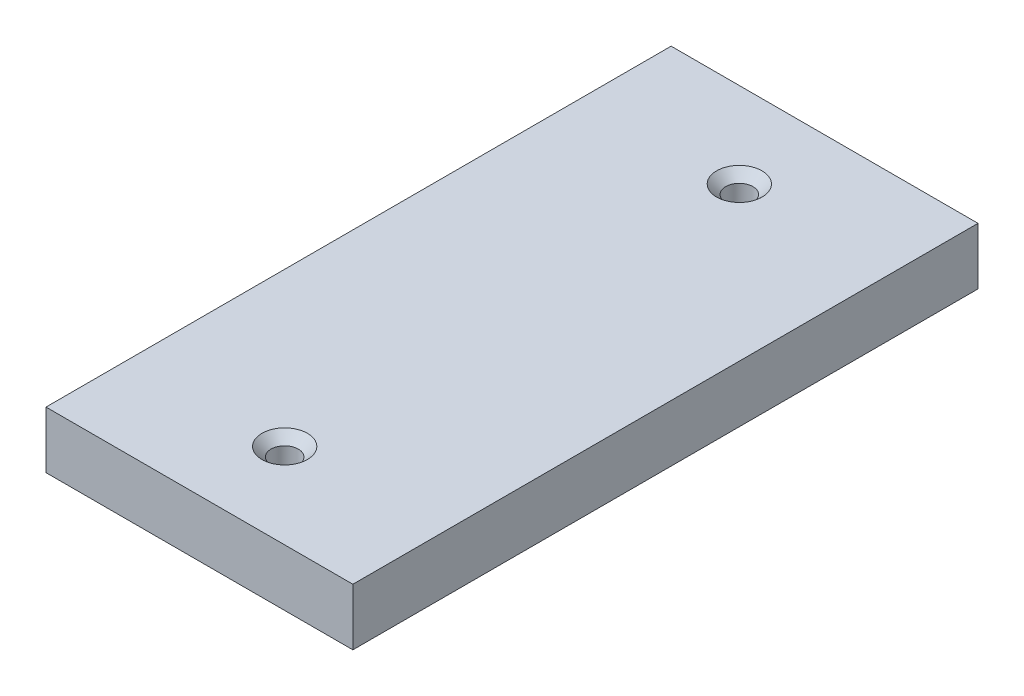
from build123d import *

# Parameters (mm, degrees)
SKETCH_2_W          = 54
SKETCH_2_H          = 110
EXTRUDE_1_DEPTH     = 5
CUT_EXTRUDE_1_REACH = 64.081
SKETCH_3_R          = 2.4
CHAMFER_1_SIZE      = 1.6


with BuildPart() as part:
    # Эскиз2 → Бобышка-Вытянуть1 (new, symmetric)
    with BuildSketch(Plane(origin=(0, 0, 0), x_dir=(1, 0, 0), z_dir=(0, 1, 0))):
        Rectangle(SKETCH_2_W, SKETCH_2_H)
    extrude(amount=EXTRUDE_1_DEPTH, both=True)

    # Эскиз3 → Вырез-Вытянуть1 (cut, up to next)
    with BuildSketch(Plane(origin=(0, 5, 0), x_dir=(1, 0, 0), z_dir=(0, 1, 0)), mode=Mode.PRIVATE) as cut_extrude_1_sk1:
        with Locations(Location((0, 40, 0), (0, 0, 270))):
            Circle(SKETCH_3_R)
    cut_extrude_1_tool1 = extrude(cut_extrude_1_sk1.sketch, amount=-CUT_EXTRUDE_1_REACH, mode=Mode.PRIVATE) & part.part
    # Эскиз3 → Вырез-Вытянуть1 (cut, up to next)
    with BuildSketch(Plane(origin=(0, 5, 0), x_dir=(1, 0, 0), z_dir=(0, 1, 0)), mode=Mode.PRIVATE) as cut_extrude_1_sk2:
        with Locations(Location((0, -40, 0), (0, 0, 270))):
            Circle(SKETCH_3_R)
    cut_extrude_1_tool2 = extrude(cut_extrude_1_sk2.sketch, amount=-CUT_EXTRUDE_1_REACH, mode=Mode.PRIVATE) & part.part
    add(cut_extrude_1_tool1.solids().sort_by_distance((0, 5, -40))[0], mode=Mode.SUBTRACT)
    add(cut_extrude_1_tool2.solids().sort_by_distance((0, 5, 40))[0], mode=Mode.SUBTRACT)

    # Фаска1
    chamfer_1_edges = [part.edges().sort_by_distance(p)[0] for p in [
        (0, 5, -42.4),
        (0, 5, 37.6),
    ]]
    chamfer(chamfer_1_edges, length=CHAMFER_1_SIZE)


solid = part.part
